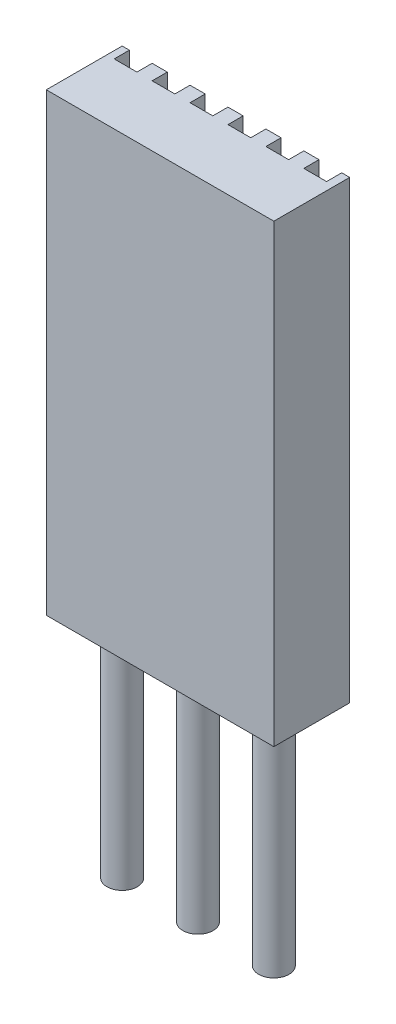
from build123d import *

# Parameters (mm, degrees)
BOSS_EXTRUDE1_DEPTH = 60
SKETCH2_R           = 2
BOSS_EXTRUDE2_DEPTH = 30


with BuildPart() as part:
    # Sketch1 → Boss-Extrude1 (new body)
    with BuildSketch(Plane(origin=(0, 0, 0), x_dir=(1, 0, 0), z_dir=(0, 1, 0))):
        Polygon((-15, 5), (-14.049599683, 5), (-14.049599683, 3), (-11.049599683, 3), (-11.049599683, 5), (-9.049599683, 5), (-9.049599683, 3), (-6.049599683, 3), (-6.049599683, 5), (-4.049599683, 5), (-4.049599683, 3), (-1.049599683, 3), (-1.049599683, 5), (0.950400317, 5), (0.950400317, 3), (3.950400317, 3), (3.950400317, 5), (5.950400317, 5), (5.950400317, 3), (8.950400317, 3), (8.950400317, 5), (10.950400317, 5), (10.950400317, 3), (13.950400317, 3), (13.950400317, 5), (15, 5), (15, -5), (-15, -5), align=None)
    extrude(amount=BOSS_EXTRUDE1_DEPTH)

    # Sketch2 → Boss-Extrude2 (add)
    with BuildSketch(Plane.XZ):
        with Locations(Location((0, 0, 0), (0, 0, 90))):
            Circle(SKETCH2_R)
        with Locations(Location((10, 0, 0), (0, 0, 90))):
            Circle(SKETCH2_R)
        with Locations(Location((-10, 0, 0), (0, 0, 90))):
            Circle(SKETCH2_R)
    extrude(amount=BOSS_EXTRUDE2_DEPTH)


solid = part.part
